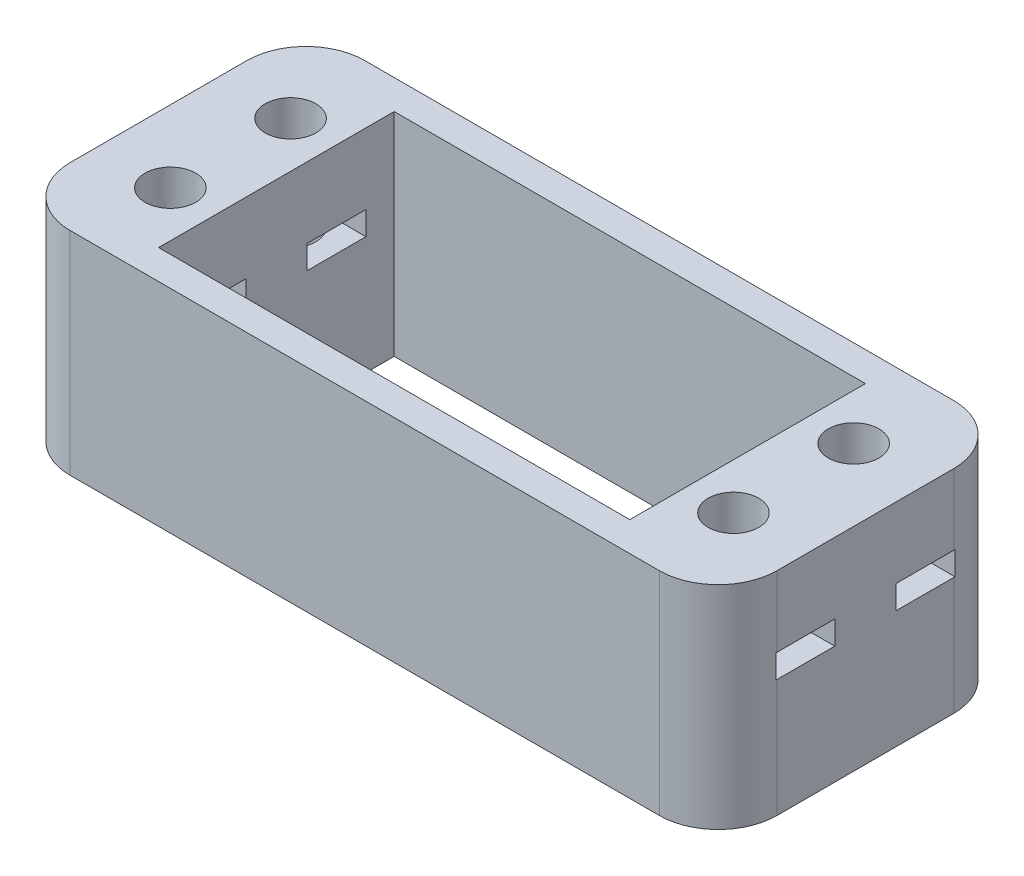
from build123d import *

# Parameters (mm, degrees)
ESQUISSE1_W                  = 60
ESQUISSE1_H                  = 18
BOSS_EXTRU_1_DEPTH           = 25
ESQUISSE2_W                  = 40
ESQUISSE2_H                  = 20
ENL_V_MAT_EXTRU_1_DEPTH      = 30
CONG_1_R                     = 5
ESQUISSE3_R                  = 2.15
ENL_V_MAT_EXTRU_2_DEPTH      = 30
ENL_V_MAT_EXTRU_3_DEPTH      = 66.620118866
ENL_V_MAT_EXTRU_3_DEPTH_BACK = 80
ESQUISSE4_W                  = 5
ESQUISSE4_H                  = 2


with BuildPart() as part:
    # Esquisse1 → Boss.-Extru.1 (new body)
    with BuildSketch(Plane.XY):
        Rectangle(ESQUISSE1_W, ESQUISSE1_H)
    extrude(amount=BOSS_EXTRU_1_DEPTH)

    # Esquisse2 → Enlèv. mat.-Extru.1 (cut)
    with BuildSketch(Plane.XZ.offset(9)):
        with Locations((0, 12.5)):
            Rectangle(ESQUISSE2_W, ESQUISSE2_H)
    extrude(amount=-ENL_V_MAT_EXTRU_1_DEPTH, mode=Mode.SUBTRACT)

    # Congé1
    cong_1_edges = [part.edges().sort_by_distance(p)[0] for p in [
        (-30, 0, 25),
        (30, 0, 25),
        (-30, 0, 0),
        (30, 0, 0),
    ]]
    fillet(cong_1_edges, radius=CONG_1_R)

    # Esquisse3 → Enlèv. mat.-Extru.2 (cut)
    with BuildSketch(Plane(origin=(0, -9, 0), x_dir=(-1, 0, 0), z_dir=(0, -1, 0))):
        with Locations(Location((23.9, -17.6, 0), (0, 0, 90))):
            Circle(ESQUISSE3_R)
        with Locations(Location((23.9, -7.4, 0), (0, 0, 90))):
            Circle(ESQUISSE3_R)
        with Locations(Location((-23.9, -7.4, 0), (0, 0, 90))):
            Circle(ESQUISSE3_R)
        with Locations(Location((-23.9, -17.6, 0), (0, 0, 90))):
            Circle(ESQUISSE3_R)
    extrude(amount=-ENL_V_MAT_EXTRU_2_DEPTH, mode=Mode.SUBTRACT)

    # Esquisse4 → Enlèv. mat.-Extru.3 (cut, two sides: drawn at the far end of the back side and taken through both)
    with BuildSketch(Plane.ZY.offset(30).offset(-ENL_V_MAT_EXTRU_3_DEPTH_BACK)):
        with Locations((7.4, 2)):
            Rectangle(ESQUISSE4_W, ESQUISSE4_H)
        with Locations((17.6, 2)):
            Rectangle(ESQUISSE4_W, ESQUISSE4_H)
    extrude(amount=ENL_V_MAT_EXTRU_3_DEPTH + ENL_V_MAT_EXTRU_3_DEPTH_BACK, mode=Mode.SUBTRACT)


solid = part.part
